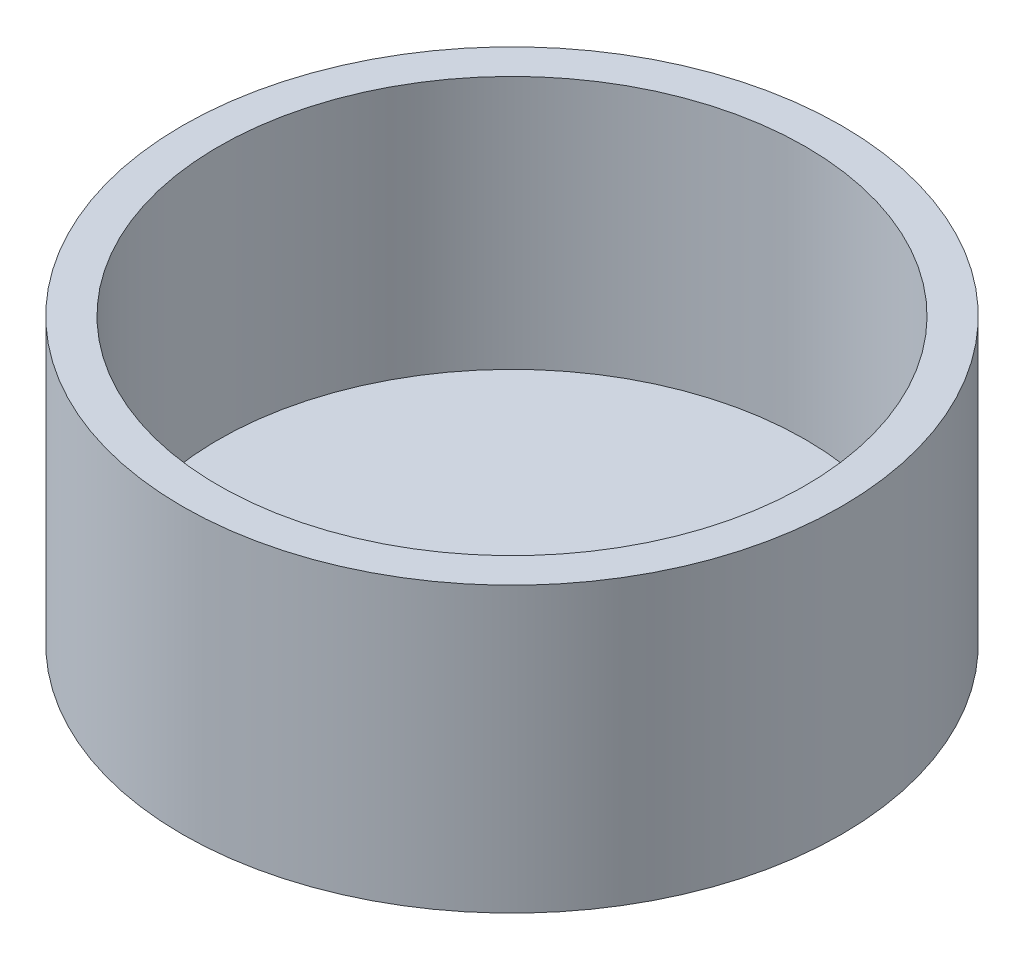
from build123d import *


with BuildPart() as part:
    # Sketch1 → Revolve1 (revolve)
    with BuildSketch(Plane.XY, mode=Mode.PRIVATE) as revolve1_sk:
        Polygon((0, 0), (0, 5.9), (57.15, 5.9), (57.15, 55.3), (64.2, 55.3), (64.2, 0), align=None)
    revolve(revolve1_sk.sketch.rotate(Axis((0, 0, 0), (0, 1, 0)), 90), axis=Axis((0, 0, 0), (0, 1, 0)))


solid = part.part
